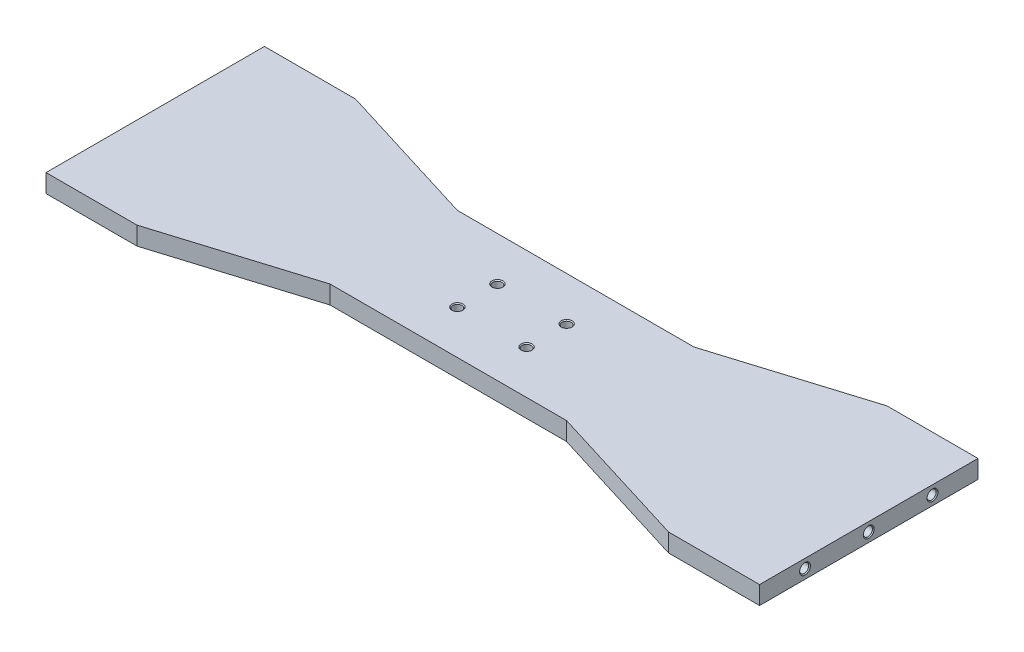
from build123d import *

# Parameters (mm, degrees)
CROQUIS1_W              = 392
CROQUIS1_H              = 120
SALIENTE_EXTRUIR1_DEPTH = 10
CROQUIS2_R              = 2.5
CORTAR_EXTRUIR1_DEPTH   = 411.078041353
CHAFL_N1_SIZE           = 0.5
CROQUIS3_R              = 2.5
CORTAR_EXTRUIR2_DEPTH   = 30
CORTAR_EXTRUIR3_START   = -30
CROQUIS4_R              = 2.5
CORTAR_EXTRUIR3_DEPTH   = 30
CHAFL_N2_SIZE           = 0.5
CORTAR_EXTRUIR4_DEPTH   = 411.078041353


with BuildPart() as part:
    # Croquis1 → Saliente-Extruir1 (new body)
    with BuildSketch(Plane(origin=(0, 0, 0), x_dir=(1, 0, 0), z_dir=(0, 1, 0))):
        with Locations((196, 60)):
            Rectangle(CROQUIS1_W, CROQUIS1_H)
    extrude(amount=-SALIENTE_EXTRUIR1_DEPTH)

    # Croquis2 → Cortar-Extruir1 (cut, through all)
    with BuildSketch(Plane.XZ.offset(10)):
        with Locations(Location((177, -49, 0), (0, 0, 270))):
            Circle(CROQUIS2_R)
        with Locations(Location((177, -71, 0), (0, 0, 270))):
            Circle(CROQUIS2_R)
        with Locations(Location((215, -49, 0), (0, 0, 270))):
            Circle(CROQUIS2_R)
        with Locations(Location((215, -71, 0), (0, 0, 270))):
            Circle(CROQUIS2_R)
    extrude(amount=-CORTAR_EXTRUIR1_DEPTH, mode=Mode.SUBTRACT)

    # Chaflán1
    chafl_n1_edges = [part.edges().sort_by_distance(p)[0] for p in [
        (177, 0, -46.5),
        (177, -10, -46.5),
        (177, 0, -68.5),
        (177, -10, -68.5),
        (215, 0, -46.5),
        (215, -10, -46.5),
        (215, 0, -68.5),
        (215, -10, -68.5),
    ]]
    chamfer(chafl_n1_edges, length=CHAFL_N1_SIZE)

    # Croquis3 → Cortar-Extruir2 (cut)
    with BuildSketch(Plane(origin=(392, 0, 0), x_dir=(0, 0, -1), z_dir=(1, 0, 0))):
        with Locations((25, -5)):
            Circle(CROQUIS3_R)
        with Locations((60, -5)):
            Circle(CROQUIS3_R)
        with Locations((95, -5)):
            Circle(CROQUIS3_R)
    extrude(amount=-CORTAR_EXTRUIR2_DEPTH, mode=Mode.SUBTRACT)

    # Croquis4 → Cortar-Extruir3 (cut)
    with BuildSketch(Plane.ZY.offset(CORTAR_EXTRUIR3_START)):
        with Locations(Location((-25, -5, 0), (0, 0, 180))):
            Circle(CROQUIS4_R)
        with Locations(Location((-60, -5, 0), (0, 0, 180))):
            Circle(CROQUIS4_R)
        with Locations(Location((-95, -5, 0), (0, 0, 180))):
            Circle(CROQUIS4_R)
    extrude(amount=CORTAR_EXTRUIR3_DEPTH, mode=Mode.SUBTRACT)

    # Chaflán2
    chafl_n2_edges = [part.edges().sort_by_distance(p)[0] for p in [
        (392, -5, -22.5),
        (392, -5, -57.5),
        (392, -5, -92.5),
        (0, -5, -22.5),
        (0, -5, -57.5),
        (0, -5, -92.5),
    ]]
    chamfer(chafl_n2_edges, length=CHAFL_N2_SIZE)

    # Croquis5 → Cortar-Extruir4 (cut, through all)
    with BuildSketch(Plane.XZ.offset(10)):
        Polygon((50, 0), (131, -25), (261, -25), (342, 0), align=None)
        Polygon((261, -95), (342, -120), (50, -120), (131, -95), align=None)
    extrude(amount=-CORTAR_EXTRUIR4_DEPTH, mode=Mode.SUBTRACT)


solid = part.part
